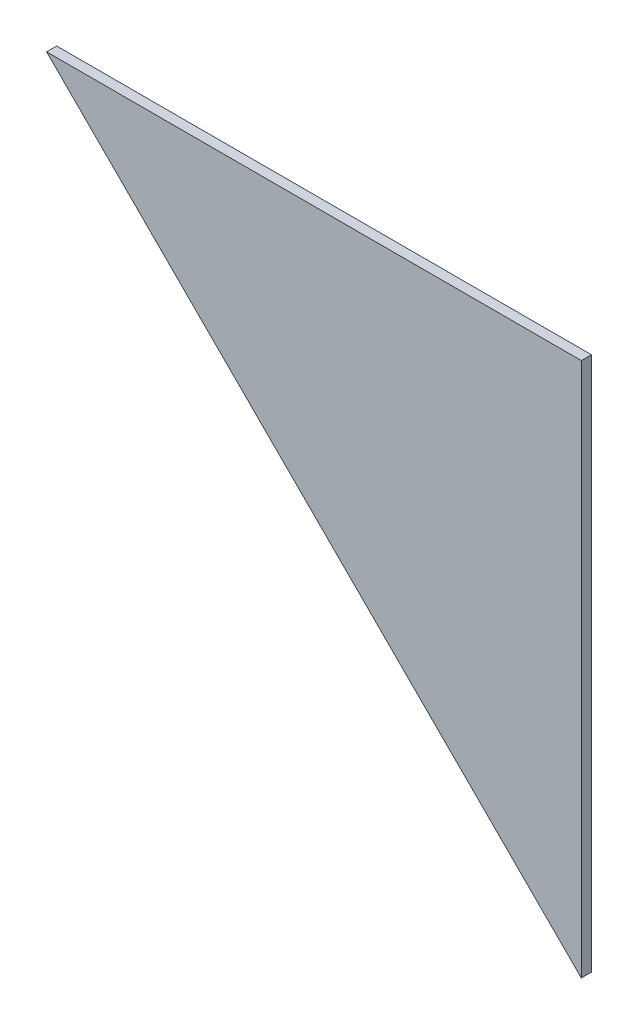
from build123d import *

# Parameters (mm, degrees)
EXTRUDE_1_DEPTH = 2


with BuildPart() as part:
    # 草圖1 → 填料-伸長1 (new body)
    with BuildSketch(Plane.XY):
        Polygon((0, 0), (0, 106.066017178), (-106.066017178, 106.066017178), align=None)
    extrude(amount=EXTRUDE_1_DEPTH)


solid = part.part
